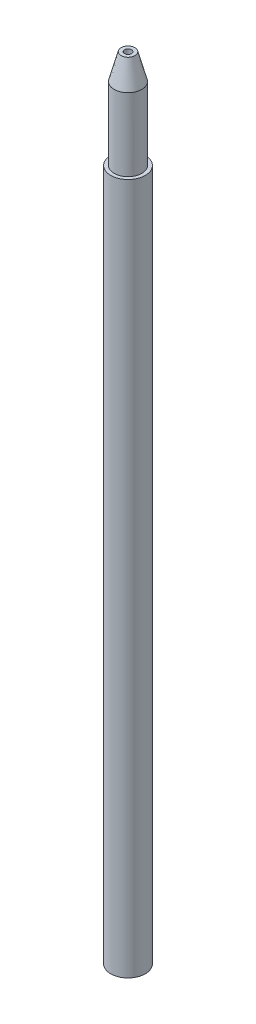
from build123d import *

# Parameters (mm, degrees)
DIAM_TRE_DU_PER_AGE_3_0_3_1_D     = 3
DIAM_TRE_DU_PER_AGE_3_0_3_1_DEPTH = 40
DIAM_TRE_DU_PER_AGE_3_0_3_1_TIP   = 0.901290929
CHANFREIN1_SIZE                   = 2
CHANFREIN1_SIZE2                  = 7.464101615


with BuildPart() as part:
    # Esquisse1 → Révolution1 (revolve)
    with BuildSketch(Plane.XY, mode=Mode.PRIVATE) as r_volution1_sk:
        Polygon((1, -35), (1, 193.5), (4, 193.5), (4, 165), (5, 165), (5, 20), (5, -35), align=None)
    revolve(r_volution1_sk.sketch.rotate(Axis((0, 0, 0), (0, 1, 0)), 90), axis=Axis((0, 0, 0), (0, 1, 0)))

    # Diamètre du perçage Ø3.0 (3)1
    with Locations(Plane(origin=(0, -35, 0), x_dir=(-1, 0, 0), z_dir=(0, -1, 0))):
        with Locations((0, 0)):
            Hole(DIAM_TRE_DU_PER_AGE_3_0_3_1_D / 2, depth=DIAM_TRE_DU_PER_AGE_3_0_3_1_DEPTH)
            with Locations((0, 0, -(DIAM_TRE_DU_PER_AGE_3_0_3_1_DEPTH + DIAM_TRE_DU_PER_AGE_3_0_3_1_TIP / 2))):  # 118° drill point
                Cone(0, DIAM_TRE_DU_PER_AGE_3_0_3_1_D / 2, DIAM_TRE_DU_PER_AGE_3_0_3_1_TIP, mode=Mode.SUBTRACT)

    # Chanfrein1
    chanfrein1_edges = [part.edges().sort_by_distance(p)[0] for p in [
        (0, 193.5, 4),
    ]]
    chanfrein1_side = [part.faces().sort_by_distance(p)[0] for p in [
        (0, 193.5, 1.113137085),
    ]]
    chamfer(chanfrein1_edges, length=CHANFREIN1_SIZE, length2=CHANFREIN1_SIZE2, reference=chanfrein1_side[0])


solid = part.part
